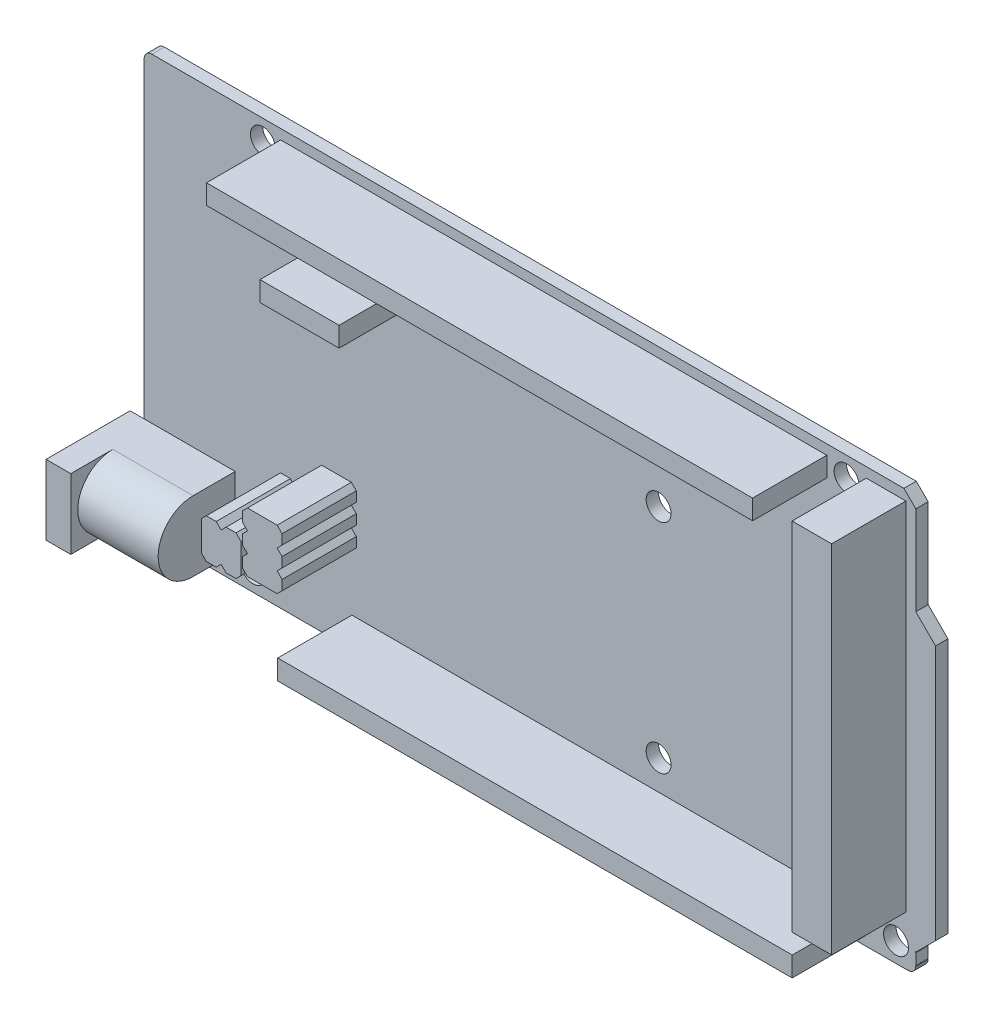
from build123d import *

# Parameters (mm, degrees)
SKETCH_20_R           = 1.5999968
BOSS_EXTRUDE1_DEPTH   = 1.5875
BOSS_EXTRUDE3_START   = 1.5875
SKETCH_21_W           = 5.073903667
SKETCH_21_H           = 45.712510943
BOSS_EXTRUDE3_DEPTH   = 9.525
BOSS_EXTRUDE3_2_DEPTH = 9.525
BOSS_EXTRUDE3_3_DEPTH = 9.525
SKETCH_21_W_2         = 10.150310815
SKETCH_21_H_2         = 2.551495436
BOSS_EXTRUDE3_4_DEPTH = 9.525
SKETCH_21_W_3         = 70.109338124
SKETCH_21_H_3         = 2.523533961
BOSS_EXTRUDE3_5_DEPTH = 9.525
SKETCH_21_W_4         = 66.044705072
SKETCH_21_H_4         = 2.556578821
BOSS_EXTRUDE3_6_DEPTH = 9.525
BOSS_EXTRUDE6_START   = 1.5875
BOSS_EXTRUDE6_DEPTH   = 10.795
CUT_EXTRUDE4_DEPTH    = 10.3124


with BuildPart() as part:
    # 20 → Boss-Extrude1 (new body)
    with BuildSketch(Plane.XY):
        with BuildLine():
            Line((99.06, 51.816), (97.536, 53.34))
            Line((97.536, 53.34), (0.999998, 53.34))
            ThreePointArc((0.999998, 53.34), (0.292892414, 53.047107586), (0, 52.340002))
            Line((0, 52.340002), (0, 0.999998))
            ThreePointArc((0, 0.999998), (0.292892414, 0.292892414), (0.999998, 0))
            Line((0.999998, 0), (97.996502, 0))
            ThreePointArc((97.996502, 0), (98.015100719, 0.044901281), (98.060002, 0.0635))
            ThreePointArc((98.060002, 0.0635), (98.104184738, 0.045608504), (98.123469987, 0.002016083))
            ThreePointArc((98.123469987, 0.002016083), (98.767107586, 0.292892414), (99.057983917, 0.936530013))
            ThreePointArc((99.057983917, 0.936530013), (99.014391496, 0.955815262), (98.9965, 0.999998))
            ThreePointArc((98.9965, 0.999998), (99.015098719, 1.044899281), (99.06, 1.063498))
            Line((99.06, 1.063498), (99.06, 2.476491629))
            ThreePointArc((99.06, 2.476491629), (99.001325916, 2.564303602), (99.1049072, 2.5849072))
            Line((99.1049072, 2.5849072), (101.555098719, 5.035098719))
            Line((101.555098719, 5.035098719), (101.6, 5.08))
            Line((101.6, 5.08), (101.6, 5.1435))
            Line((101.6, 5.1435), (101.6, 37.846))
            Line((101.6, 37.846), (99.06, 40.386))
            Line((99.06, 40.386), (99.06, 51.816))
        make_face()
        with Locations((13.97, 2.54)):
            Circle(SKETCH_20_R, mode=Mode.SUBTRACT)
        with Locations((66.04, 7.62)):
            Circle(SKETCH_20_R, mode=Mode.SUBTRACT)
        with Locations((96.52, 2.54)):
            Circle(SKETCH_20_R, mode=Mode.SUBTRACT)
        with Locations((15.24, 50.8)):
            Circle(SKETCH_20_R, mode=Mode.SUBTRACT)
        with Locations((66.04, 35.56)):
            Circle(SKETCH_20_R, mode=Mode.SUBTRACT)
        with Locations((90.17, 50.8)):
            Circle(SKETCH_20_R, mode=Mode.SUBTRACT)
    extrude(amount=BOSS_EXTRUDE1_DEPTH)


with BuildPart() as body_2:
    # 21 → Boss-Extrude3 (new body)
    with BuildSketch(Plane.XY.offset(BOSS_EXTRUDE3_START)):
        with Locations((95.241145717, 29.200449355)):
            Rectangle(SKETCH_21_W, SKETCH_21_H)
    extrude(amount=BOSS_EXTRUDE3_DEPTH)


with BuildPart() as body_3:
    # 21 → Boss-Extrude3 2 (new body)
    with BuildSketch(Plane.XY.offset(BOSS_EXTRUDE3_START)):
        Polygon((22.7838, 10.922), (22.1488, 11.557), (22.1488, 12.827), (22.7838, 13.462), (22.1488, 14.097), (22.1488, 15.367), (22.7838, 16.002), (22.1488, 16.637), (22.1488, 17.907), (22.7838, 18.542), (26.5938, 18.542), (27.2288, 17.907), (27.2288, 16.637), (26.5938, 16.002), (27.2288, 15.367), (27.2288, 14.097), (26.5938, 13.462), (27.2288, 12.827), (27.2288, 11.557), (26.5938, 10.922), align=None)
    extrude(amount=BOSS_EXTRUDE3_2_DEPTH)


with BuildPart() as body_4:
    # 21 → Boss-Extrude3 3 (new body)
    with BuildSketch(Plane.XY.offset(BOSS_EXTRUDE3_START)):
        Polygon((20.0406, 9.9568), (19.4056, 10.5918), (18.7706, 9.9568), (17.5006, 9.9568), (16.8656, 10.5918), (16.8656, 14.4018), (17.5006, 15.0368), (18.7706, 15.0368), (19.4056, 14.4018), (20.0406, 15.0368), (21.3106, 15.0368), (21.9456, 14.4018), (21.9456, 10.5918), (21.3106, 9.9568), align=None)
    extrude(amount=BOSS_EXTRUDE3_3_DEPTH)


with BuildPart() as body_5:
    # 21 → Boss-Extrude3 4 (new body)
    with BuildSketch(Plane.XY.offset(BOSS_EXTRUDE3_START)):
        with Locations((29.472154972, 43.466052718)):
            Rectangle(SKETCH_21_W_2, SKETCH_21_H_2)
    extrude(amount=BOSS_EXTRUDE3_4_DEPTH)


with BuildPart() as body_6:
    # 21 → Boss-Extrude3 5 (new body)
    with BuildSketch(Plane.XY.offset(BOSS_EXTRUDE3_START)):
        with Locations((52.575938469, 50.80823302)):
            Rectangle(SKETCH_21_W_3, SKETCH_21_H_3)
    extrude(amount=BOSS_EXTRUDE3_5_DEPTH)


with BuildPart() as body_7:
    # 21 → Boss-Extrude3 6 (new body)
    with BuildSketch(Plane.XY.offset(BOSS_EXTRUDE3_START)):
        with Locations((59.692352536, 2.53171059)):
            Rectangle(SKETCH_21_W_4, SKETCH_21_H_4)
    extrude(amount=BOSS_EXTRUDE3_6_DEPTH)


with BuildPart() as body_8:
    # 21<6> → Boss-Extrude6 (new body)
    with BuildSketch(Plane.XY.offset(BOSS_EXTRUDE6_START)):
        Polygon((-1.8034, 12.2936), (-1.8034, 3.302), (5.969, 3.302), (11.3665, 3.302), (11.684, 3.302), (11.684, 5.5245), (11.684, 10.922), (11.684, 12.2936), (1.6764, 12.2936), align=None)
    extrude(amount=BOSS_EXTRUDE6_DEPTH)

    # Sketch4 → Cut-Extrude4 (cut)
    with BuildSketch(Plane(origin=(11.684, 0, 0), x_dir=(0, 0, -1), z_dir=(1, 0, 0))):
        with BuildLine():
            Line((-6.985, 3.302), (-21.694212729, 3.302))
            Line((-21.694212729, 3.302), (-21.694212729, 12.2936))
            Line((-21.694212729, 12.2936), (-6.985, 12.2936))
            ThreePointArc((-6.985, 12.2936), (-11.4808, 7.7978), (-6.985, 3.302))
        make_face()
    extrude(amount=-CUT_EXTRUDE4_DEPTH, mode=Mode.SUBTRACT)


solid = Compound([part.part, body_2.part, body_3.part, body_4.part, body_5.part, body_6.part, body_7.part, body_8.part])
